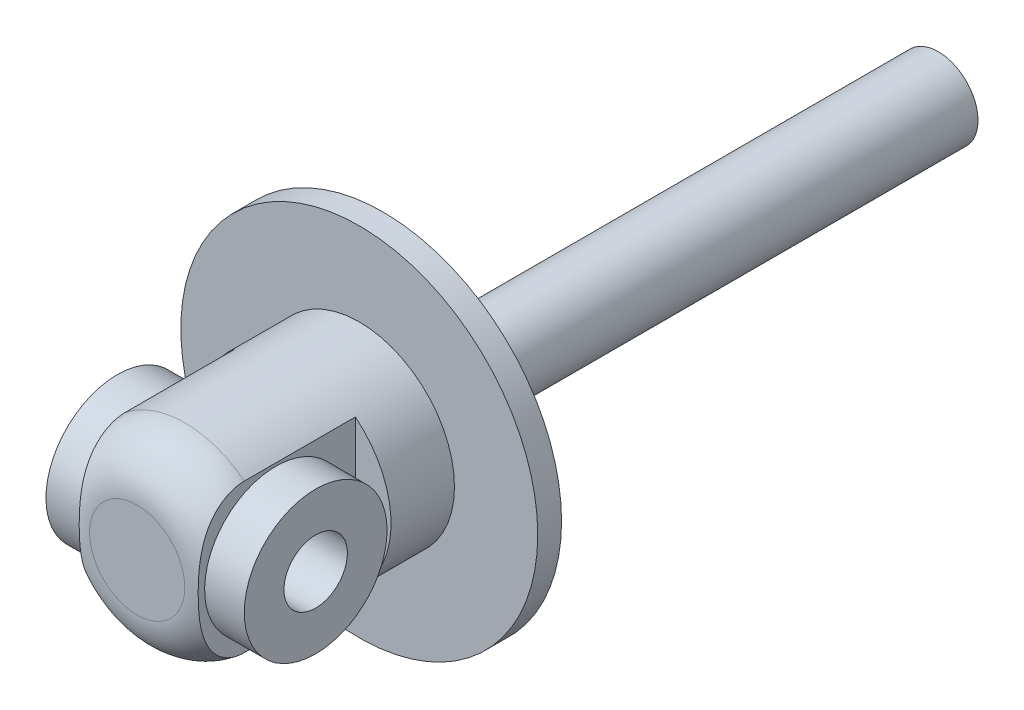
from build123d import *

# Parameters (mm, degrees)
SCHIZZO1_R                   = 5
ESTRUSIONE_ESTRUSIONE1_DEPTH = 70
SCHIZZO2_R                   = 22.5
ESTRUSIONE_ESTRUSIONE2_DEPTH = 3
SCHIZZO3_R                   = 12
ESTRUSIONE_ESTRUSIONE3_DEPTH = 28
RACCORDO1_R                  = 6
SCHIZZO4_W                   = 10
SCHIZZO4_H                   = 30
TAGLIO_ESTRUSIONE1_DEPTH     = 20
SCHIZZO7_R                   = 9
ESTRUSIONE_ESTRUSIONE4_DEPTH = 5
SCHIZZO8_R                   = 4
TAGLIO_ESTRUSIONE3_DEPTH     = 25


with BuildPart() as part:
    # Schizzo1 → Estrusione-Estrusione1 (new body)
    with BuildSketch(Plane.XY):
        Circle(SCHIZZO1_R)
    extrude(amount=ESTRUSIONE_ESTRUSIONE1_DEPTH)

    # Schizzo2 → Estrusione-Estrusione2 (add)
    with BuildSketch(Plane.XY.offset(70)):
        Circle(SCHIZZO2_R)
    extrude(amount=ESTRUSIONE_ESTRUSIONE2_DEPTH)

    # Schizzo3 → Estrusione-Estrusione3 (add)
    with BuildSketch(Plane.XY.offset(73)):
        Circle(SCHIZZO3_R)
    extrude(amount=ESTRUSIONE_ESTRUSIONE3_DEPTH)

    # Raccordo1
    raccordo1_edges = [part.edges().sort_by_distance(p)[0] for p in [
        (-12, 0, 101),
    ]]
    fillet(raccordo1_edges, radius=RACCORDO1_R)

    # Schizzo4 → Taglio-Estrusione1 (cut)
    with BuildSketch(Plane.XY.offset(101)):
        with Locations((12.5, 0)):
            Rectangle(SCHIZZO4_W, SCHIZZO4_H)
    taglio_estrusione1 = extrude(amount=-TAGLIO_ESTRUSIONE1_DEPTH, mode=Mode.SUBTRACT)

    # Specchia1: Taglio-Estrusione1 across plane
    add(taglio_estrusione1.mirror(Plane(origin=(0, 0, 0), x_dir=(0, 0, 1), z_dir=(1, 0, 0))), mode=Mode.SUBTRACT)

    # Schizzo7 → Estrusione-Estrusione4 (add)
    with BuildSketch(Plane(origin=(7.5, 0, 0), x_dir=(0, 0, -1), z_dir=(1, 0, 0))):
        with Locations(Location((-91, 0, 0), (0, 0, 270))):
            Circle(SCHIZZO7_R)
    estrusione_estrusione4 = extrude(amount=ESTRUSIONE_ESTRUSIONE4_DEPTH)

    # Specchia2: Estrusione-Estrusione4 across plane
    add(estrusione_estrusione4.mirror(Plane(origin=(0, 0, 0), x_dir=(0, 0, 1), z_dir=(1, 0, 0))))

    # Schizzo8 → Taglio-Estrusione3 (cut)
    with BuildSketch(Plane(origin=(12.5, 0, 0), x_dir=(0, 0, -1), z_dir=(1, 0, 0))):
        with Locations(Location((-91, 0, 0), (0, 0, 90))):
            Circle(SCHIZZO8_R)
    extrude(amount=-TAGLIO_ESTRUSIONE3_DEPTH, mode=Mode.SUBTRACT)


solid = part.part
